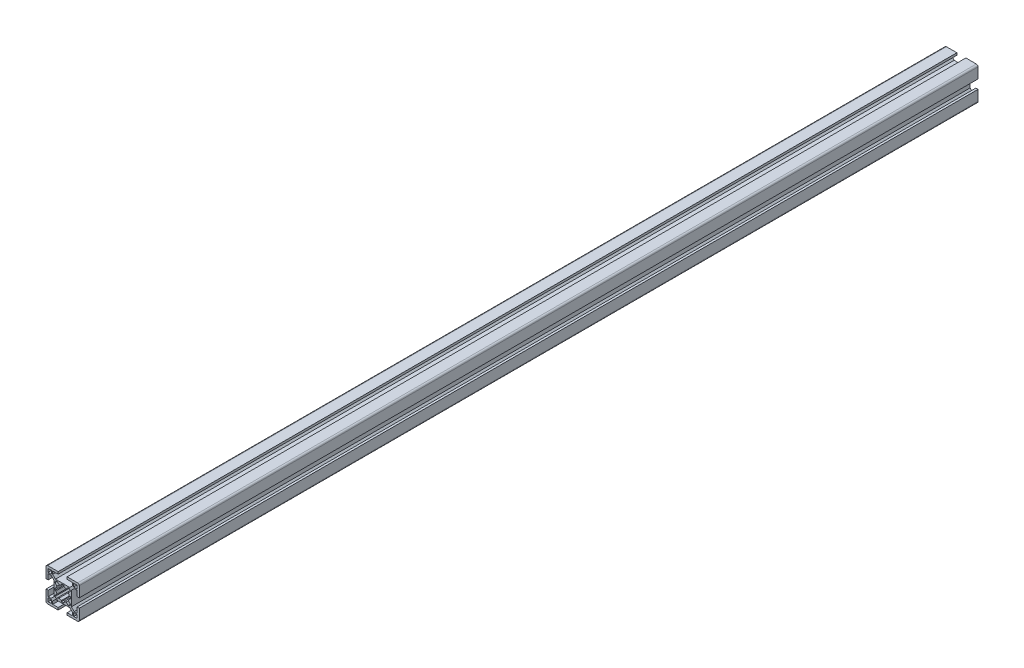
from build123d import *

# Parameters (mm, degrees)
ESBO_O1_W                = 3
ESBO_O1_H                = 3
RESSALTO_EXTRUS_O1_DEPTH = 405


with BuildPart() as part:
    # Esboço1 → Ressalto-extrusão1 (new, symmetric)
    with BuildSketch(Plane.XY):
        with BuildLine():
            Line((15, 13.5), (15, 4.05))
            Line((15, 4.05), (13, 4.05))
            Line((13, 4.05), (13, 9))
            Line((13, 9), (10.414213562, 9))
            Line((10.414213562, 9), (7.9, 6.485786438))
            Line((7.9, 6.485786438), (7.9, -7.36e-07))
            Line((7.9, -7.36e-07), (7.9, -6.485786438))
            Line((7.9, -6.485786438), (10.414213562, -9))
            Line((10.414213562, -9), (13, -9))
            Line((13, -9), (13, -4.05))
            Line((13, -4.05), (15, -4.05))
            Line((15, -4.05), (15, -13.5))
            ThreePointArc((15, -13.5), (14.560660172, -14.560660172), (13.5, -15))
            Line((13.5, -15), (4.05, -15))
            Line((4.05, -15), (4.05, -13))
            Line((4.05, -13), (9, -13))
            Line((9, -13), (9, -10.414213562))
            Line((9, -10.414213562), (6.485786438, -7.9))
            Line((6.485786438, -7.9), (-7.36e-07, -7.9))
            Line((-7.36e-07, -7.9), (-6.485786438, -7.9))
            Line((-6.485786438, -7.9), (-9, -10.414213562))
            Line((-9, -10.414213562), (-9, -13))
            Line((-9, -13), (-4.05, -13))
            Line((-4.05, -13), (-4.05, -15))
            Line((-4.05, -15), (-13.5, -15))
            ThreePointArc((-13.5, -15), (-14.560660172, -14.560660172), (-15, -13.5))
            Line((-15, -13.5), (-15, -4.05))
            Line((-15, -4.05), (-13, -4.05))
            Line((-13, -4.05), (-13, -9))
            Line((-13, -9), (-10.414213562, -9))
            Line((-10.414213562, -9), (-7.9, -6.485786438))
            Line((-7.9, -6.485786438), (-7.9, 7.36e-07))
            Line((-7.9, 7.36e-07), (-7.9, 6.485786438))
            Line((-7.9, 6.485786438), (-10.414213562, 9))
            Line((-10.414213562, 9), (-13, 9))
            Line((-13, 9), (-13, 4.05))
            Line((-13, 4.05), (-15, 4.05))
            Line((-15, 4.05), (-15, 13.5))
            ThreePointArc((-15, 13.5), (-14.560660172, 14.560660172), (-13.5, 15))
            Line((-13.5, 15), (-4.05, 15))
            Line((-4.05, 15), (-4.05, 13))
            Line((-4.05, 13), (-9, 13))
            Line((-9, 13), (-9, 10.414213562))
            Line((-9, 10.414213562), (-6.485786438, 7.9))
            Line((-6.485786438, 7.9), (7.36e-07, 7.9))
            Line((7.36e-07, 7.9), (6.485786438, 7.9))
            Line((6.485786438, 7.9), (9, 10.414213562))
            Line((9, 10.414213562), (9, 13))
            Line((9, 13), (4.05, 13))
            Line((4.05, 13), (4.05, 15))
            Line((4.05, 15), (13.5, 15))
            ThreePointArc((13.5, 15), (14.560660172, 14.560660172), (15, 13.5))
        make_face()
        with Locations((-11.5, 11.5)):
            Rectangle(ESBO_O1_W, ESBO_O1_H, mode=Mode.SUBTRACT)
        with BuildLine():
            Line((-6.9, 1.000000736), (-6.9, 7.36e-07))
            Line((-6.9, 7.36e-07), (-6.9, -1.000000736))
            Line((-6.9, -1.000000736), (-5.966782929, -1.000000736))
            ThreePointArc((-5.966782929, -1.000000736), (-5.665339038, -2.122836212), (-5.154690025, -3.167281286))
            Line((-5.154690025, -3.167281286), (-6.9, -4.91259126))
            Line((-6.9, -4.91259126), (-6.9, -5.827922061))
            Line((-6.9, -5.827922061), (-5.827922061, -6.9))
            Line((-5.827922061, -6.9), (-4.91259126, -6.9))
            Line((-4.91259126, -6.9), (-3.167281286, -5.154690025))
            ThreePointArc((-3.167281286, -5.154690025), (-2.122836212, -5.665339038), (-1.000000736, -5.966782929))
            Line((-1.000000736, -5.966782929), (-1.000000736, -6.9))
            Line((-1.000000736, -6.9), (-7.36e-07, -6.9))
            Line((-7.36e-07, -6.9), (1.000000736, -6.9))
            Line((1.000000736, -6.9), (1.000000736, -5.966782929))
            ThreePointArc((1.000000736, -5.966782929), (2.122836212, -5.665339038), (3.167281286, -5.154690025))
            Line((3.167281286, -5.154690025), (4.91259126, -6.9))
            Line((4.91259126, -6.9), (5.827922061, -6.9))
            Line((5.827922061, -6.9), (6.9, -5.827922061))
            Line((6.9, -5.827922061), (6.9, -4.91259126))
            Line((6.9, -4.91259126), (5.154690025, -3.167281286))
            ThreePointArc((5.154690025, -3.167281286), (5.665339038, -2.122836212), (5.966782929, -1.000000736))
            Line((5.966782929, -1.000000736), (6.9, -1.000000736))
            Line((6.9, -1.000000736), (6.9, -7.36e-07))
            Line((6.9, -7.36e-07), (6.9, 1.000000736))
            Line((6.9, 1.000000736), (5.966782929, 1.000000736))
            ThreePointArc((5.966782929, 1.000000736), (5.665339038, 2.122836212), (5.154690025, 3.167281286))
            Line((5.154690025, 3.167281286), (6.9, 4.91259126))
            Line((6.9, 4.91259126), (6.9, 5.827922061))
            Line((6.9, 5.827922061), (5.827922061, 6.9))
            Line((5.827922061, 6.9), (4.91259126, 6.9))
            Line((4.91259126, 6.9), (3.167281286, 5.154690025))
            ThreePointArc((3.167281286, 5.154690025), (2.122836212, 5.665339038), (1.000000736, 5.966782929))
            Line((1.000000736, 5.966782929), (1.000000736, 6.9))
            Line((1.000000736, 6.9), (7.36e-07, 6.9))
            Line((7.36e-07, 6.9), (-1.000000736, 6.9))
            Line((-1.000000736, 6.9), (-1.000000736, 5.966782929))
            ThreePointArc((-1.000000736, 5.966782929), (-2.122836212, 5.665339038), (-3.167281286, 5.154690025))
            Line((-3.167281286, 5.154690025), (-4.91259126, 6.9))
            Line((-4.91259126, 6.9), (-5.827922061, 6.9))
            Line((-5.827922061, 6.9), (-6.9, 5.827922061))
            Line((-6.9, 5.827922061), (-6.9, 4.91259126))
            Line((-6.9, 4.91259126), (-5.154690025, 3.167281286))
            ThreePointArc((-5.154690025, 3.167281286), (-5.665339038, 2.122836212), (-5.966782929, 1.000000736))
            Line((-5.966782929, 1.000000736), (-6.9, 1.000000736))
        make_face(mode=Mode.SUBTRACT)
        with Locations((11.5, 11.5)):
            Rectangle(ESBO_O1_W, ESBO_O1_H, mode=Mode.SUBTRACT)
        with Locations((11.5, -11.5)):
            Rectangle(ESBO_O1_W, ESBO_O1_H, mode=Mode.SUBTRACT)
        with Locations((-11.5, -11.5)):
            Rectangle(ESBO_O1_W, ESBO_O1_H, mode=Mode.SUBTRACT)
    extrude(amount=RESSALTO_EXTRUS_O1_DEPTH, both=True)


solid = part.part
